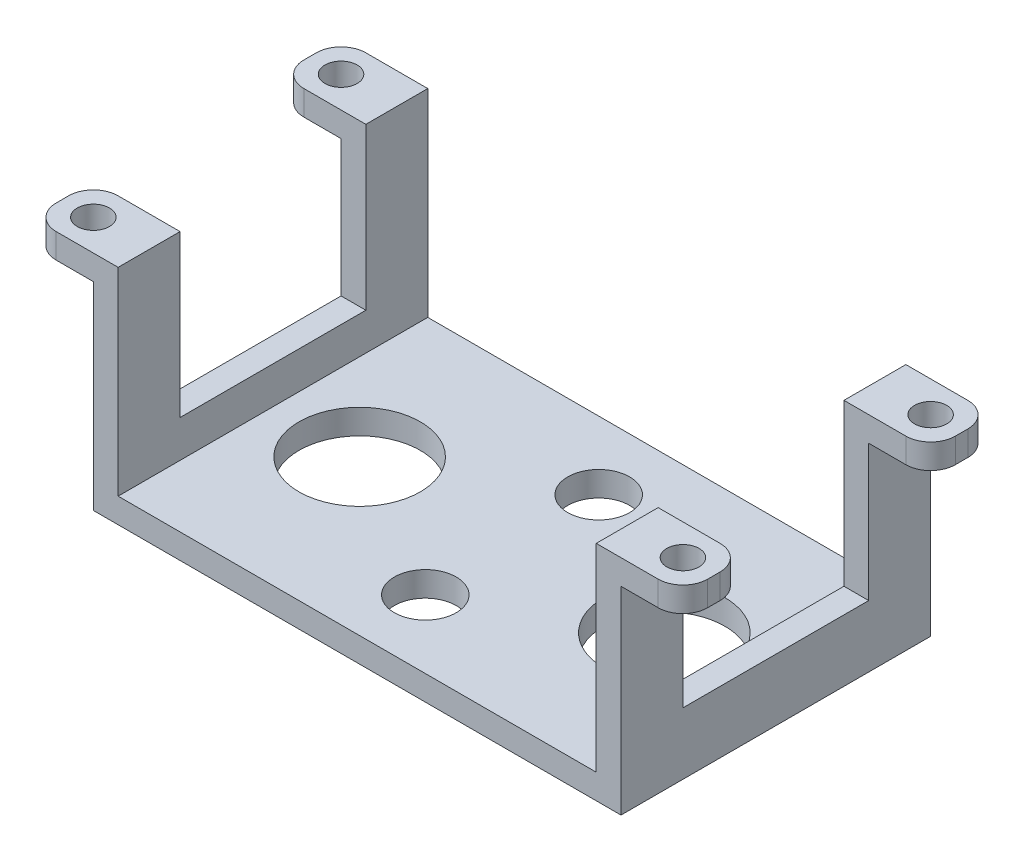
from build123d import *

# Parameters (mm, degrees)
SZKIC1_W                        = 42.6
SZKIC1_H                        = 25
DODANIE_WYCI_GNI_CIE2_DEPTH     = 18
SKORUPA5_T                      = -2
SZKIC2_R                        = 1.3
DODANIE_WYCI_GNI_CIE3_DEPTH     = 2
SZKIC3_R                        = 4.9
SZKIC3_R_2                      = 2.5
WYTNIJ_WYCI_GNI_CIE1_DEPTH      = 2
WYTNIJ_WYCI_GNI_CIE2_DEPTH      = 53.402385442
WYTNIJ_WYCI_GNI_CIE2_DEPTH_BACK = 53.402385442
SZKIC4_W                        = 15
SZKIC4_H                        = 13


with BuildPart() as part:
    # Szkic1 → Dodanie-wyciągnięcie2 (new body)
    with BuildSketch(Plane(origin=(0, 0, 0), x_dir=(1, 0, 0), z_dir=(0, 1, 0))):
        Rectangle(SZKIC1_W, SZKIC1_H)
    extrude(amount=DODANIE_WYCI_GNI_CIE2_DEPTH)

    # Skorupa5
    skorupa5_openings = [part.faces().sort_by_distance(p)[0] for p in [
        (0, 18, 0),
        (0, 9, -12.5),
        (0, 9, 12.5),
    ]]
    offset(amount=SKORUPA5_T, openings=skorupa5_openings, kind=Kind.INTERSECTION)

    # Szkic2 → Dodanie-wyciągnięcie3 (add)
    # profile 1 of 4: a face of its own
    with BuildSketch(Plane(origin=(0, 18, 0), x_dir=(1, 0, 0), z_dir=(0, 1, 0))):
        with BuildLine():
            Line((-21.3, 12.5), (-24.3, 12.5))
            ThreePointArc((-24.3, 12.5), (-25.714213562, 11.914213562), (-26.3, 10.5))
            Line((-26.3, 10.5), (-26.3, 9.5))
            ThreePointArc((-26.3, 9.5), (-25.714213562, 8.085786438), (-24.3, 7.5))
            Line((-24.3, 7.5), (-21.3, 7.5))
            Line((-21.3, 7.5), (-21.3, 12.5))
        make_face()
        with Locations(Location((-23.8, 10, 0), (0, 0, 270))):
            Circle(SZKIC2_R, mode=Mode.SUBTRACT)
    # profile 2 of 4: a face of its own
    with BuildSketch(Plane(origin=(0, 18, 0), x_dir=(1, 0, 0), z_dir=(0, 1, 0))):
        with BuildLine():
            Line((-21.3, -7.5), (-24.3, -7.5))
            ThreePointArc((-24.3, -7.5), (-25.714213562, -8.085786438), (-26.3, -9.5))
            Line((-26.3, -9.5), (-26.3, -10.5))
            ThreePointArc((-26.3, -10.5), (-25.714213562, -11.914213562), (-24.3, -12.5))
            Line((-24.3, -12.5), (-21.3, -12.5))
            Line((-21.3, -12.5), (-21.3, -7.5))
        make_face()
        with Locations(Location((-23.8, -10, 0), (0, 0, 90))):
            Circle(SZKIC2_R, mode=Mode.SUBTRACT)
    # profile 3 of 4: a face of its own
    with BuildSketch(Plane(origin=(0, 18, 0), x_dir=(1, 0, 0), z_dir=(0, 1, 0))):
        with BuildLine():
            Line((21.3, -12.5), (21.3, -7.5))
            Line((21.3, -7.5), (24.3, -7.5))
            ThreePointArc((24.3, -7.5), (25.714213562, -8.085786438), (26.3, -9.5))
            Line((26.3, -9.5), (26.3, -10.5))
            ThreePointArc((26.3, -10.5), (25.714213562, -11.914213562), (24.3, -12.5))
            Line((24.3, -12.5), (21.3, -12.5))
        make_face()
        with Locations(Location((23.8, -10, 0), (0, 0, 270))):
            Circle(SZKIC2_R, mode=Mode.SUBTRACT)
    # profile 4 of 4: a face of its own
    with BuildSketch(Plane(origin=(0, 18, 0), x_dir=(1, 0, 0), z_dir=(0, 1, 0))):
        with BuildLine():
            Line((21.3, 7.5), (24.3, 7.5))
            ThreePointArc((24.3, 7.5), (25.714213562, 8.085786438), (26.3, 9.5))
            Line((26.3, 9.5), (26.3, 10.5))
            ThreePointArc((26.3, 10.5), (25.714213562, 11.914213562), (24.3, 12.5))
            Line((24.3, 12.5), (21.3, 12.5))
            Line((21.3, 12.5), (21.3, 7.5))
        make_face()
        with Locations(Location((23.8, 10, 0), (0, 0, 90))):
            Circle(SZKIC2_R, mode=Mode.SUBTRACT)
    extrude(amount=-DODANIE_WYCI_GNI_CIE3_DEPTH)

    # Szkic3 → Wytnij-wyciągnięcie1 (cut)
    with BuildSketch(Plane(origin=(0, 2, 0), x_dir=(1, 0, 0), z_dir=(0, 1, 0))):
        with Locations(Location((-12.3, 0, 0), (0, 0, 270))):
            Circle(SZKIC3_R)
        with Locations(Location((12.3, 0, 0), (0, 0, 270))):
            Circle(SZKIC3_R)
        with Locations(Location((0, 7, 0), (0, 0, 270))):
            Circle(SZKIC3_R_2)
        with Locations(Location((0, -7, 0), (0, 0, 270))):
            Circle(SZKIC3_R_2)
    extrude(amount=-WYTNIJ_WYCI_GNI_CIE1_DEPTH, mode=Mode.SUBTRACT)

    # Szkic4 → Wytnij-wyciągnięcie2 (cut, two sides: drawn at the far end of the back side and taken through both)
    with BuildSketch(Plane.ZY.offset(21.3).offset(-WYTNIJ_WYCI_GNI_CIE2_DEPTH_BACK)):
        with Locations((0, 11.5)):
            Rectangle(SZKIC4_W, SZKIC4_H)
    extrude(amount=WYTNIJ_WYCI_GNI_CIE2_DEPTH + WYTNIJ_WYCI_GNI_CIE2_DEPTH_BACK, mode=Mode.SUBTRACT)


solid = part.part
